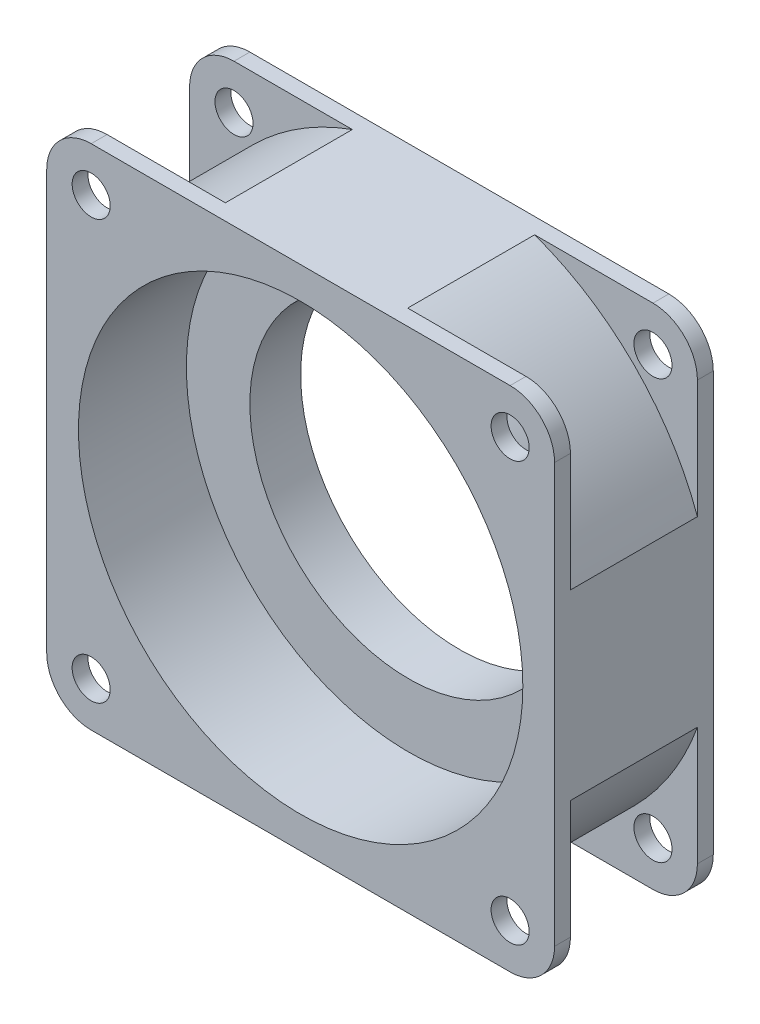
from build123d import *

# Parameters (mm, degrees)
BOSS_EXTRUDE1_START   = 10
SKETCH1_R             = 3
BOSS_EXTRUDE1_DEPTH   = 2.5
BOSS_EXTRUDE1_2_DEPTH = 2.5
BOSS_EXTRUDE1_3_DEPTH = 2.5
BOSS_EXTRUDE1_4_DEPTH = 2.5
SKETCH1_3_R           = 35
BOSS_EXTRUDE2_DEPTH   = 12.5
BOSS_EXTRUDE4_START   = -4.5
SKETCH1_5_R           = 25
BOSS_EXTRUDE4_DEPTH   = 8


with BuildPart() as part:
    # Sketch1 → Boss-Extrude1 (new body)
    with BuildSketch(Plane.XY.offset(BOSS_EXTRUDE1_START)):
        with BuildLine():
            ThreePointArc((-40, -33), (-37.949747468, -37.949747468), (-33, -40))
            Line((-33, -40), (-14.361406616, -40))
            ThreePointArc((-14.361406616, -40), (-30.0520382, -30.0520382), (-40, -14.361406616))
            Line((-40, -14.361406616), (-40, -33))
        make_face()
        with Locations((-33, -33)):
            Circle(SKETCH1_R, mode=Mode.SUBTRACT)
    boss_extrude1 = extrude(amount=BOSS_EXTRUDE1_DEPTH)



with BuildPart() as body_2:
    # Sketch1 → Boss-Extrude1 2 (new body)
    with BuildSketch(Plane.XY.offset(BOSS_EXTRUDE1_START)):
        with BuildLine():
            ThreePointArc((40, -14.361406616), (30.0520382, -30.0520382), (14.361406616, -40))
            Line((14.361406616, -40), (33, -40))
            ThreePointArc((33, -40), (37.949747468, -37.949747468), (40, -33))
            Line((40, -33), (40, -14.361406616))
        make_face()
        with Locations((33, -33)):
            Circle(SKETCH1_R, mode=Mode.SUBTRACT)
    boss_extrude1_2 = extrude(amount=BOSS_EXTRUDE1_2_DEPTH)


with BuildPart() as body_3:
    # Sketch1 → Boss-Extrude1 3 (new body)
    with BuildSketch(Plane.XY.offset(BOSS_EXTRUDE1_START)):
        with BuildLine():
            Line((-40, 33), (-40, 14.361406616))
            ThreePointArc((-40, 14.361406616), (-30.0520382, 30.0520382), (-14.361406616, 40))
            Line((-14.361406616, 40), (-33, 40))
            ThreePointArc((-33, 40), (-37.949747468, 37.949747468), (-40, 33))
        make_face()
        with Locations((-33, 33)):
            Circle(SKETCH1_R, mode=Mode.SUBTRACT)
    boss_extrude1_3 = extrude(amount=BOSS_EXTRUDE1_3_DEPTH)


with BuildPart() as body_4:
    # Sketch1 → Boss-Extrude1 4 (new body)
    with BuildSketch(Plane.XY.offset(BOSS_EXTRUDE1_START)):
        with BuildLine():
            ThreePointArc((14.361406616, 40), (30.0520382, 30.0520382), (40, 14.361406616))
            Line((40, 14.361406616), (40, 33))
            ThreePointArc((40, 33), (37.949747468, 37.949747468), (33, 40))
            Line((33, 40), (14.361406616, 40))
        make_face()
        with Locations((33, 33)):
            Circle(SKETCH1_R, mode=Mode.SUBTRACT)
    boss_extrude1_4 = extrude(amount=BOSS_EXTRUDE1_4_DEPTH)


with BuildPart() as part_1:
    add(part.part)

    add(body_2.part)  # Boss-Extrude2 merges body 2

    add(body_3.part)  # Boss-Extrude2 merges body 3

    add(body_4.part)  # Boss-Extrude2 merges body 4
    # Sketch1<3> → Boss-Extrude2 (add, symmetric)
    with BuildSketch(Plane.XY):
        with BuildLine():
            ThreePointArc((-40, -14.361406616), (-30.0520382, -30.0520382), (-14.361406616, -40))
            Line((-14.361406616, -40), (14.361406616, -40))
            ThreePointArc((14.361406616, -40), (30.0520382, -30.0520382), (40, -14.361406616))
            Line((40, -14.361406616), (40, 14.361406616))
            ThreePointArc((40, 14.361406616), (30.0520382, 30.0520382), (14.361406616, 40))
            Line((14.361406616, 40), (-14.361406616, 40))
            ThreePointArc((-14.361406616, 40), (-30.0520382, 30.0520382), (-40, 14.361406616))
            Line((-40, 14.361406616), (-40, -14.361406616))
        make_face()
        Circle(SKETCH1_3_R, mode=Mode.SUBTRACT)
    extrude(amount=BOSS_EXTRUDE2_DEPTH, both=True)

    # Mirror1: Boss-Extrude1, Boss-Extrude1 2, Boss-Extrude1 3, Boss-Extrude1 4 across plane
    add(boss_extrude1.mirror(Plane.XY))
    add(boss_extrude1_2.mirror(Plane.XY))
    add(boss_extrude1_3.mirror(Plane.XY))
    add(boss_extrude1_4.mirror(Plane.XY))

    # Sketch1<5> → Boss-Extrude4 (add)
    with BuildSketch(Plane.XY.offset(BOSS_EXTRUDE4_START)):
        with BuildLine():
            ThreePointArc((-40, -14.361406616), (-30.0520382, -30.0520382), (-14.361406616, -40))
            Line((-14.361406616, -40), (14.361406616, -40))
            ThreePointArc((14.361406616, -40), (30.0520382, -30.0520382), (40, -14.361406616))
            Line((40, -14.361406616), (40, 14.361406616))
            ThreePointArc((40, 14.361406616), (30.0520382, 30.0520382), (14.361406616, 40))
            Line((14.361406616, 40), (-14.361406616, 40))
            ThreePointArc((-14.361406616, 40), (-30.0520382, 30.0520382), (-40, 14.361406616))
            Line((-40, 14.361406616), (-40, -14.361406616))
        make_face()
        Circle(SKETCH1_5_R, mode=Mode.SUBTRACT)
    extrude(amount=-BOSS_EXTRUDE4_DEPTH)


solid = part_1.part
